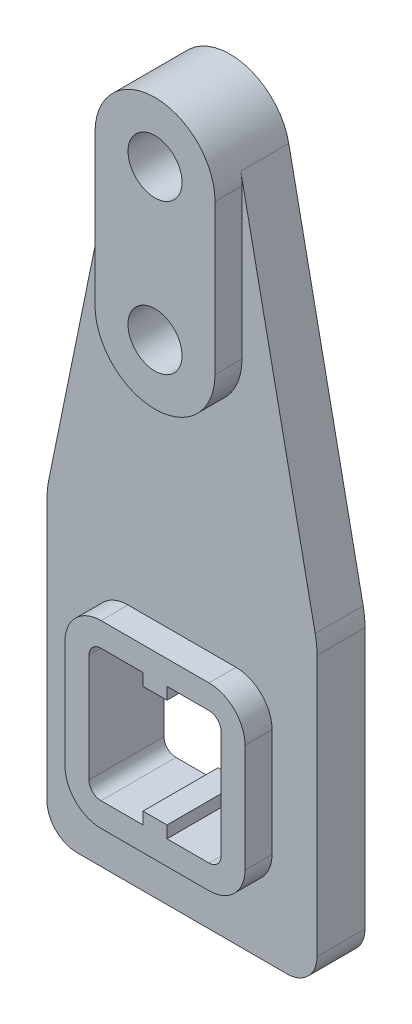
from build123d import *

# Parameters (mm, degrees)
EXTRUDE_1_DEPTH     = 16
SKETCH_1_3_R        = 9
EXTRUDE_2_DEPTH     = 25
EXTRUDE_3_DEPTH     = 25
CUT_EXTRUDE_1_DEPTH = 25


with BuildPart() as part:
    # 草图1 → 凸台-拉伸1 (new body)
    with BuildSketch(Plane.XY):
        with BuildLine():
            Line((-35, -50), (35, -50))
            ThreePointArc((35, -50), (42.071067812, -47.071067812), (45, -40))
            Line((45, -40), (45, 46.958512764))
            ThreePointArc((45, 46.958512764), (44.847001034, 49.98448852), (44.389564715, 52.979599532))
            Line((44.389564715, 52.979599532), (19.593043195, 174.014057595))
            ThreePointArc((19.593043195, 174.014057595), (19.898000702, 172.017317043), (20, 170))
            Line((20, 170), (20, 120))
            ThreePointArc((20, 120), (0, 100), (-20, 120))
            Line((-20, 120), (-20, 170))
            ThreePointArc((-20, 170), (-19.898000688, 172.017317185), (-19.593043138, 174.014057873))
            Line((-19.593043138, 174.014057873), (-44.389564715, 52.979599532))
            ThreePointArc((-44.389564715, 52.979599532), (-44.847001034, 49.98448852), (-45, 46.958512764))
            Line((-45, 46.958512764), (-45, -40))
            ThreePointArc((-45, -40), (-42.071067812, -47.071067812), (-35, -50))
        make_face()
    extrude(amount=EXTRUDE_1_DEPTH)

    # 草图1<3> → 凸台-拉伸2 (add)
    with BuildSketch(Plane.XY):
        with BuildLine():
            ThreePointArc((20, 170), (19.898000702, 172.017317043), (19.593043195, 174.014057595))
            ThreePointArc((19.593043195, 174.014057595), (1.42e-07, 190), (-19.593043138, 174.014057873))
            ThreePointArc((-19.593043138, 174.014057873), (-19.898000688, 172.017317185), (-20, 170))
            Line((-20, 170), (-20, 120))
            ThreePointArc((-20, 120), (0, 100), (20, 120))
            Line((20, 120), (20, 170))
        make_face()
        with Locations((0, 120)):
            Circle(SKETCH_1_3_R, mode=Mode.SUBTRACT)
        with Locations((0, 170)):
            Circle(SKETCH_1_3_R, mode=Mode.SUBTRACT)
    extrude(amount=EXTRUDE_2_DEPTH)

    # 草图2 → 凸台-拉伸3 (add)
    with BuildSketch(Plane.XY):
        with BuildLine():
            Line((18, -30), (-18, -30))
            ThreePointArc((-18, -30), (-26.485281374, -26.485281374), (-30, -18))
            Line((-30, -18), (-30, 18))
            ThreePointArc((-30, 18), (-26.485281374, 26.485281374), (-18, 30))
            Line((-18, 30), (18, 30))
            ThreePointArc((18, 30), (26.485281374, 26.485281374), (30, 18))
            Line((30, 18), (30, -18))
            ThreePointArc((30, -18), (26.485281374, -26.485281374), (18, -30))
        make_face()
    extrude(amount=EXTRUDE_3_DEPTH)

    # 草图3 → 切除-拉伸1 (cut)
    with BuildSketch(Plane.XY.offset(25)):
        with BuildLine():
            Line((-4, 22), (-18, 22))
            ThreePointArc((-18, 22), (-20.828427125, 20.828427125), (-22, 18))
            Line((-22, 18), (-22, -18))
            ThreePointArc((-22, -18), (-20.828427125, -20.828427125), (-18, -22))
            Line((-18, -22), (-4, -22))
            Line((-4, -22), (-4, -18))
            Line((-4, -18), (4, -18))
            Line((4, -18), (4, -22))
            Line((4, -22), (18, -22))
            ThreePointArc((18, -22), (20.828427125, -20.828427125), (22, -18))
            Line((22, -18), (22, 18))
            ThreePointArc((22, 18), (20.828427125, 20.828427125), (18, 22))
            Line((18, 22), (4, 22))
            Line((4, 22), (4, 18))
            Line((4, 18), (-4, 18))
            Line((-4, 18), (-4, 22))
        make_face()
    extrude(amount=-CUT_EXTRUDE_1_DEPTH, mode=Mode.SUBTRACT)


solid = part.part
